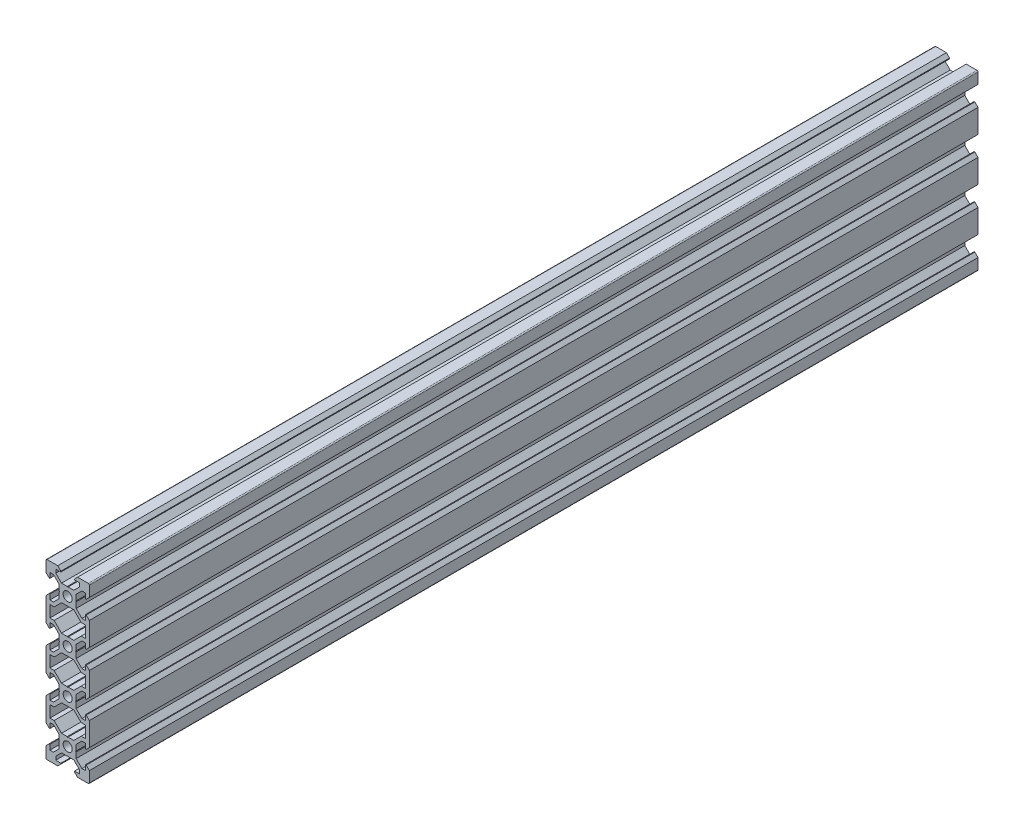
from build123d import *

# Parameters (mm, degrees)
BOSS_EXTRU_1_DEPTH = 410


with BuildPart() as part:
    # Esquisse1 → Boss.-Extru.1 (new body)
    with BuildSketch(Plane.XY):
        with BuildLine():
            Line((-9.5, 10), (-4.58, 10))
            Line((-4.58, 10), (-3.125, 8.545))
            Line((-3.125, 8.545), (-3.125, 8.2))
            Line((-3.125, 8.2), (-5.5, 8.2))
            Line((-5.5, 8.2), (-5.5, 6.560660172))
            Line((-5.5, 6.560660172), (-2.839339828, 3.9))
            Line((-2.839339828, 3.9), (-0.21, 3.9))
            Line((-0.21, 3.9), (0, 3.69))
            Line((0, 3.69), (0, 2.1))
            ThreePointArc((0, 2.1), (-2.1, 0), (0, -2.1))
            Line((0, -2.1), (0, -3.69))
            Line((0, -3.69), (-0.21, -3.9))
            Line((-0.21, -3.9), (-2.839339828, -3.9))
            Line((-2.839339828, -3.9), (-6.239339828, -7.3))
            Line((-6.239339828, -7.3), (-8.2, -7.3))
            Line((-8.2, -7.3), (-8.2, -12.7))
            Line((-8.2, -12.7), (-6.239339828, -12.7))
            Line((-6.239339828, -12.7), (-2.839339828, -16.1))
            Line((-2.839339828, -16.1), (-0.21, -16.1))
            Line((-0.21, -16.1), (0, -16.31))
            Line((0, -16.31), (0, -17.9))
            ThreePointArc((0, -17.9), (-2.1, -20), (0, -22.1))
            Line((0, -22.1), (0, -23.69))
            Line((0, -23.69), (-0.21, -23.9))
            Line((-0.21, -23.9), (-2.839339828, -23.9))
            Line((-2.839339828, -23.9), (-6.239339828, -27.3))
            Line((-6.239339828, -27.3), (-8.2, -27.3))
            Line((-8.2, -27.3), (-8.2, -32.7))
            Line((-8.2, -32.7), (-6.239339828, -32.7))
            Line((-6.239339828, -32.7), (-2.839339828, -36.1))
            Line((-2.839339828, -36.1), (-0.21, -36.1))
            Line((-0.21, -36.1), (0, -36.31))
            Line((0, -36.31), (0, -37.9))
            ThreePointArc((0, -37.9), (-2.1, -40), (0, -42.1))
            Line((0, -42.1), (0, -43.69))
            Line((0, -43.69), (-0.21, -43.9))
            Line((-0.21, -43.9), (-2.839339828, -43.9))
            Line((-2.839339828, -43.9), (-6.239339828, -47.3))
            Line((-6.239339828, -47.3), (-8.2, -47.3))
            Line((-8.2, -47.3), (-8.2, -52.7))
            Line((-8.2, -52.7), (-6.239339828, -52.7))
            Line((-6.239339828, -52.7), (-2.839339828, -56.1))
            Line((-2.839339828, -56.1), (-0.21, -56.1))
            Line((-0.21, -56.1), (0, -56.31))
            Line((0, -56.31), (0, -57.9))
            ThreePointArc((0, -57.9), (-2.1, -60), (0, -62.1))
            Line((0, -62.1), (0, -63.69))
            Line((0, -63.69), (-0.21, -63.9))
            Line((-0.21, -63.9), (-2.839339828, -63.9))
            Line((-2.839339828, -63.9), (-5.5, -66.560660172))
            Line((-5.5, -66.560660172), (-5.5, -68.2))
            Line((-5.5, -68.2), (-3.125, -68.2))
            Line((-3.125, -68.2), (-3.125, -68.545))
            Line((-3.125, -68.545), (-4.58, -70))
            Line((-4.58, -70), (-9.5, -70))
            ThreePointArc((-9.5, -70), (-9.853553391, -69.853553391), (-10, -69.5))
            Line((-10, -69.5), (-10, -64.58))
            Line((-10, -64.58), (-8.545, -63.125))
            Line((-8.545, -63.125), (-8.2, -63.125))
            Line((-8.2, -63.125), (-8.2, -65.5))
            Line((-8.2, -65.5), (-6.560660172, -65.5))
            Line((-6.560660172, -65.5), (-3.9, -62.839339828))
            Line((-3.9, -62.839339828), (-3.9, -60.21))
            Line((-3.9, -60.21), (-3.69, -60))
            Line((-3.69, -60), (-3.9, -59.79))
            Line((-3.9, -59.79), (-3.9, -57.160660172))
            Line((-3.9, -57.160660172), (-6.560660172, -54.5))
            Line((-6.560660172, -54.5), (-8.2, -54.5))
            Line((-8.2, -54.5), (-8.2, -56.875))
            Line((-8.2, -56.875), (-8.545, -56.875))
            Line((-8.545, -56.875), (-10, -55.42))
            Line((-10, -55.42), (-10, -44.58))
            Line((-10, -44.58), (-8.545, -43.125))
            Line((-8.545, -43.125), (-8.2, -43.125))
            Line((-8.2, -43.125), (-8.2, -45.5))
            Line((-8.2, -45.5), (-6.560660172, -45.5))
            Line((-6.560660172, -45.5), (-3.9, -42.839339828))
            Line((-3.9, -42.839339828), (-3.9, -40.21))
            Line((-3.9, -40.21), (-3.69, -40))
            Line((-3.69, -40), (-3.9, -39.79))
            Line((-3.9, -39.79), (-3.9, -37.160660172))
            Line((-3.9, -37.160660172), (-6.560660172, -34.5))
            Line((-6.560660172, -34.5), (-8.2, -34.5))
            Line((-8.2, -34.5), (-8.2, -36.875))
            Line((-8.2, -36.875), (-8.545, -36.875))
            Line((-8.545, -36.875), (-10, -35.42))
            Line((-10, -35.42), (-10, -24.58))
            Line((-10, -24.58), (-8.545, -23.125))
            Line((-8.545, -23.125), (-8.2, -23.125))
            Line((-8.2, -23.125), (-8.2, -25.5))
            Line((-8.2, -25.5), (-6.560660172, -25.5))
            Line((-6.560660172, -25.5), (-3.9, -22.839339828))
            Line((-3.9, -22.839339828), (-3.9, -20.21))
            Line((-3.9, -20.21), (-3.69, -20))
            Line((-3.69, -20), (-3.9, -19.79))
            Line((-3.9, -19.79), (-3.9, -17.160660172))
            Line((-3.9, -17.160660172), (-6.560660172, -14.5))
            Line((-6.560660172, -14.5), (-8.2, -14.5))
            Line((-8.2, -14.5), (-8.2, -16.875))
            Line((-8.2, -16.875), (-8.545, -16.875))
            Line((-8.545, -16.875), (-10, -15.42))
            Line((-10, -15.42), (-10, -4.58))
            Line((-10, -4.58), (-8.545, -3.125))
            Line((-8.545, -3.125), (-8.2, -3.125))
            Line((-8.2, -3.125), (-8.2, -5.5))
            Line((-8.2, -5.5), (-6.560660172, -5.5))
            Line((-6.560660172, -5.5), (-3.9, -2.839339828))
            Line((-3.9, -2.839339828), (-3.9, -0.21))
            Line((-3.9, -0.21), (-3.69, 0))
            Line((-3.69, 0), (-3.9, 0.21))
            Line((-3.9, 0.21), (-3.9, 2.839339828))
            Line((-3.9, 2.839339828), (-6.560660172, 5.5))
            Line((-6.560660172, 5.5), (-8.2, 5.5))
            Line((-8.2, 5.5), (-8.2, 3.125))
            Line((-8.2, 3.125), (-8.545, 3.125))
            Line((-8.545, 3.125), (-10, 4.58))
            Line((-10, 4.58), (-10, 9.5))
            ThreePointArc((-10, 9.5), (-9.853553391, 9.853553391), (-9.5, 10))
        make_face()
    boss_extru_1 = extrude(amount=BOSS_EXTRU_1_DEPTH)

    # Symétrie1: Boss.-Extru.1 across plane
    add(boss_extru_1.mirror(Plane(origin=(0, 3.69, 410), x_dir=(0, 0, 1), z_dir=(-1, 0, 0))))


solid = part.part
